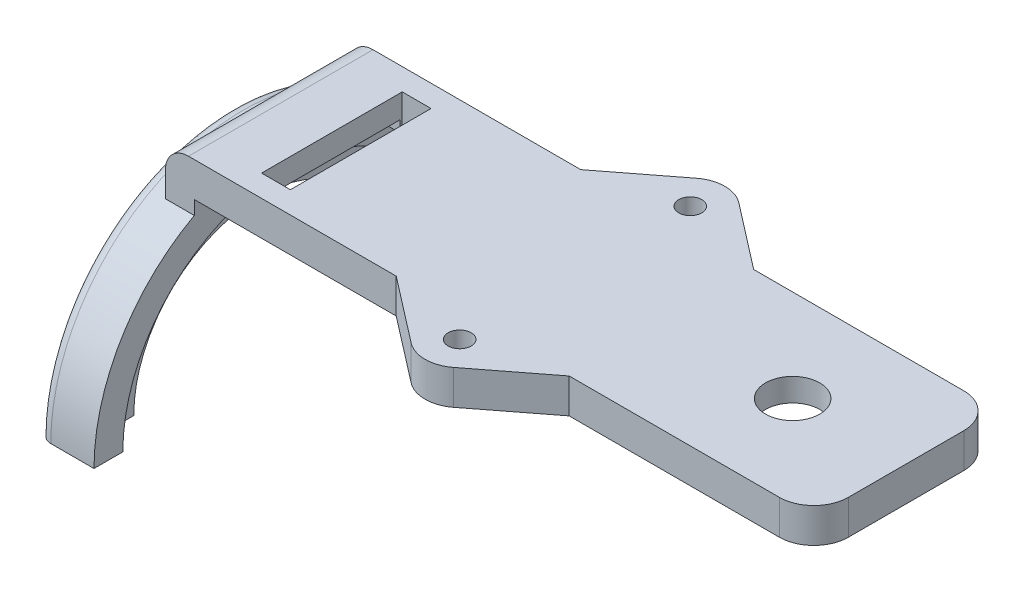
from build123d import *

# Parameters (mm, degrees)
SKETCH1_W                   = 56.235
SKETCH1_H                   = 16
SKETCH1_R                   = 2.35
SKETCH1_W_2                 = 2.5
SKETCH1_H_2                 = 12.2
BOSS_EXTRUDE1_DEPTH         = 3
ESQUISSE3_W                 = 22.7
ESQUISSE3_H                 = 11.84
ESQUISSE3_W_2               = 22.6
ENL_V_MAT_EXTRU_1_DEPTH     = 1
ESQUISSE4_R                 = 1
BOSS_EXTRU_2_DEPTH          = 3
R_VOLUTION1_ANGLE           = 90
R_VOLUTION1_OTHER_WAY_ANGLE = 90
ESQUISSE6_W                 = 2.5
ESQUISSE6_H                 = 16
BOSS_EXTRU_3_DEPTH          = 4.8
CONG_1_R                    = 2
CONG_2_R                    = 3
CONG_3_R                    = 1


with BuildPart() as part:
    # Sketch1 → Boss-Extrude1 (new body)
    with BuildSketch(Plane(origin=(0, 0, 0), x_dir=(1, 0, 0), z_dir=(0, 1, 0))):
        with Locations((28.1175, 8)):
            Rectangle(SKETCH1_W, SKETCH1_H)
        with Locations(Location((46.395, 8, 0), (0, 0, 270))):
            Circle(SKETCH1_R, mode=Mode.SUBTRACT)
        with Locations((7.685, 8)):
            Rectangle(SKETCH1_W_2, SKETCH1_H_2, mode=Mode.SUBTRACT)
    extrude(amount=BOSS_EXTRUDE1_DEPTH)

    # Esquisse3 → Enlèv. mat.-Extru.1 (cut)
    with BuildSketch(Plane.XZ):
        with Locations((11.35, -8)):
            Rectangle(ESQUISSE3_W, ESQUISSE3_H)
        with Locations((40.935, -8)):
            Rectangle(ESQUISSE3_W_2, ESQUISSE3_H)
    extrude(amount=-ENL_V_MAT_EXTRU_1_DEPTH, mode=Mode.SUBTRACT)

    # Esquisse4 → Boss.-Extru.2 (add)
    # profile 1 of 2: a face of its own
    with BuildSketch(Plane(origin=(0, 3, 0), x_dir=(1, 0, 0), z_dir=(0, 1, 0))):
        with BuildLine():
            Line((20.015, 16), (25.681747499, 20.374696879))
            ThreePointArc((25.681747499, 20.374696879), (27.515, 21), (29.348252501, 20.374696879))
            Line((29.348252501, 20.374696879), (35.015, 16))
            Line((35.015, 16), (27.515, 16))
            Line((27.515, 16), (20.015, 16))
        make_face()
        with Locations(Location((27.515, 18, 0), (0, 0, 270))):
            Circle(ESQUISSE4_R, mode=Mode.SUBTRACT)
    # profile 2 of 2: a face of its own
    with BuildSketch(Plane(origin=(0, 3, 0), x_dir=(1, 0, 0), z_dir=(0, 1, 0))):
        with BuildLine():
            Line((27.515, 0), (35.015, 0))
            Line((35.015, 0), (29.348252501, -4.374696879))
            ThreePointArc((29.348252501, -4.374696879), (27.515, -5), (25.681747499, -4.374696879))
            Line((25.681747499, -4.374696879), (20.015, 0))
            Line((20.015, 0), (27.515, 0))
        make_face()
        with Locations(Location((27.515, -2, 0), (0, 0, 90))):
            Circle(ESQUISSE4_R, mode=Mode.SUBTRACT)
    extrude(amount=-BOSS_EXTRU_2_DEPTH)



with BuildPart() as body_2:
    # Esquisse5 → Révolution1 (revolve)
    with BuildSketch(Plane.XY.offset(-8)):
        Polygon((-2.25, 0.84), (2.5, 0.84), (2.5, -1.66), (0.25, -1.66), (0.25, -4.86), (-2.25, -4.86), align=None)
    revolve(axis=Axis((-14.237579535, -15.86, -8), (-1, 0, 0)), revolution_arc=R_VOLUTION1_ANGLE)

    # Esquisse5 → Révolution1 other way (revolve)
    with BuildSketch(Plane.XY.offset(-8)):
        Polygon((-2.25, 0.84), (2.5, 0.84), (2.5, -1.66), (0.25, -1.66), (0.25, -4.86), (-2.25, -4.86), align=None)
    revolve(axis=Axis((-14.237579535, -15.86, -8), (1, 0, 0)), revolution_arc=R_VOLUTION1_OTHER_WAY_ANGLE)


with BuildPart() as part_1:
    add(part.part)

    add(body_2.part)  # Boss.-Extru.3 merges body 2
    # Esquisse6 → Boss.-Extru.3 (add)
    with BuildSketch(Plane(origin=(0, 3, 0), x_dir=(1, 0, 0), z_dir=(0, 1, 0))):
        with Locations((1.25, 8)):
            Rectangle(ESQUISSE6_W, ESQUISSE6_H)
    extrude(amount=-BOSS_EXTRU_3_DEPTH)

    # Congé1
    cong_1_edges = [part_1.edges().sort_by_distance(p)[0] for p in [
        (0, 3, -8),
    ]]
    fillet(cong_1_edges, radius=CONG_1_R)

    # Congé2
    cong_2_edges = [part_1.edges().sort_by_distance(p)[0] for p in [
        (56.235, 1.5, -16),
        (56.235, 1.5, 0),
    ]]
    fillet(cong_2_edges, radius=CONG_2_R)

    # Congé3
    cong_3_edges = [part_1.edges().sort_by_distance(p)[0] for p in [
        (-2.25, 0.84, -8),
    ]]
    fillet(cong_3_edges, radius=CONG_3_R)


solid = part_1.part
